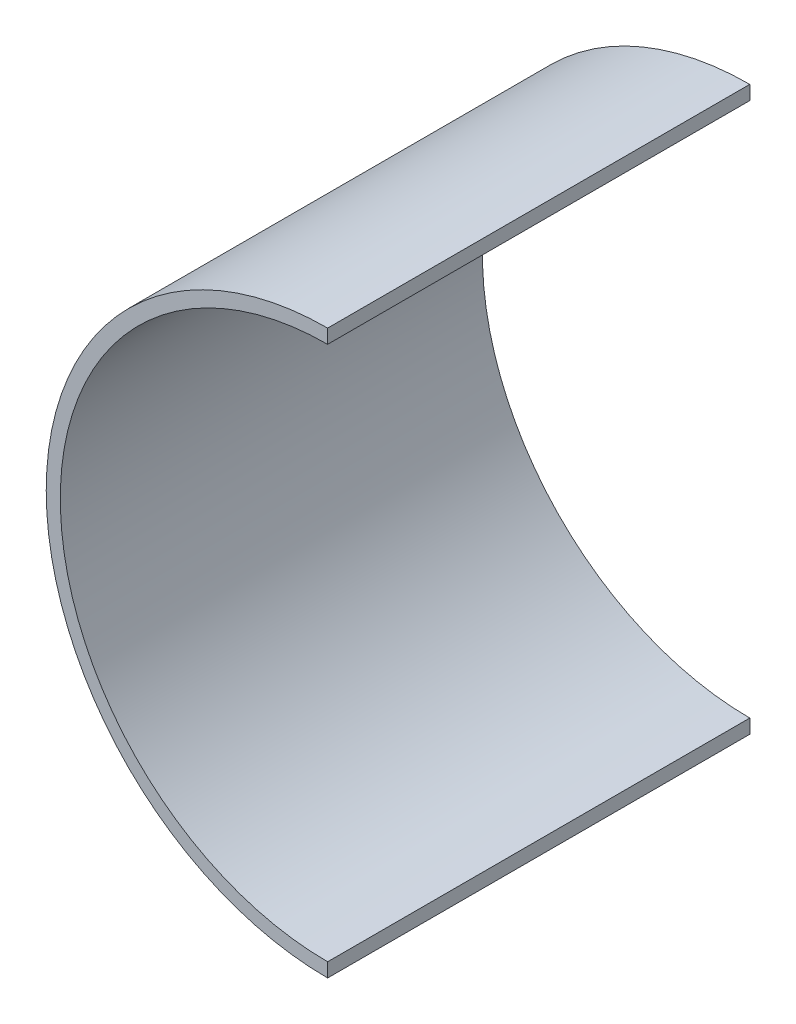
from build123d import *

# Parameters (mm, degrees)
EXTRUDE_1_DEPTH = 20
EXTRUDE_2_DEPTH = 40


with BuildPart() as part:
    # Эскиз1 → Бобышка-Вытянуть1 (new body)
    with BuildSketch(Plane.XY):
        with BuildLine():
            Line((0, 38), (0, 40))
            ThreePointArc((0, 40), (-40, 0), (0, -40))
            Line((0, -40), (0, -38))
            ThreePointArc((0, -38), (-38, 0), (0, 38))
        make_face()
    extrude(amount=EXTRUDE_1_DEPTH)

    # Эскиз2 → Бобышка-Вытянуть2 (add)
    with BuildSketch(Plane.XY.offset(20)):
        with BuildLine():
            Line((0, -38), (0, -40))
            ThreePointArc((0, -40), (-40, 0), (0, 40))
            Line((0, 40), (0, 38))
            ThreePointArc((0, 38), (-38, 0), (0, -38))
        make_face()
    extrude(amount=EXTRUDE_2_DEPTH)


solid = part.part
